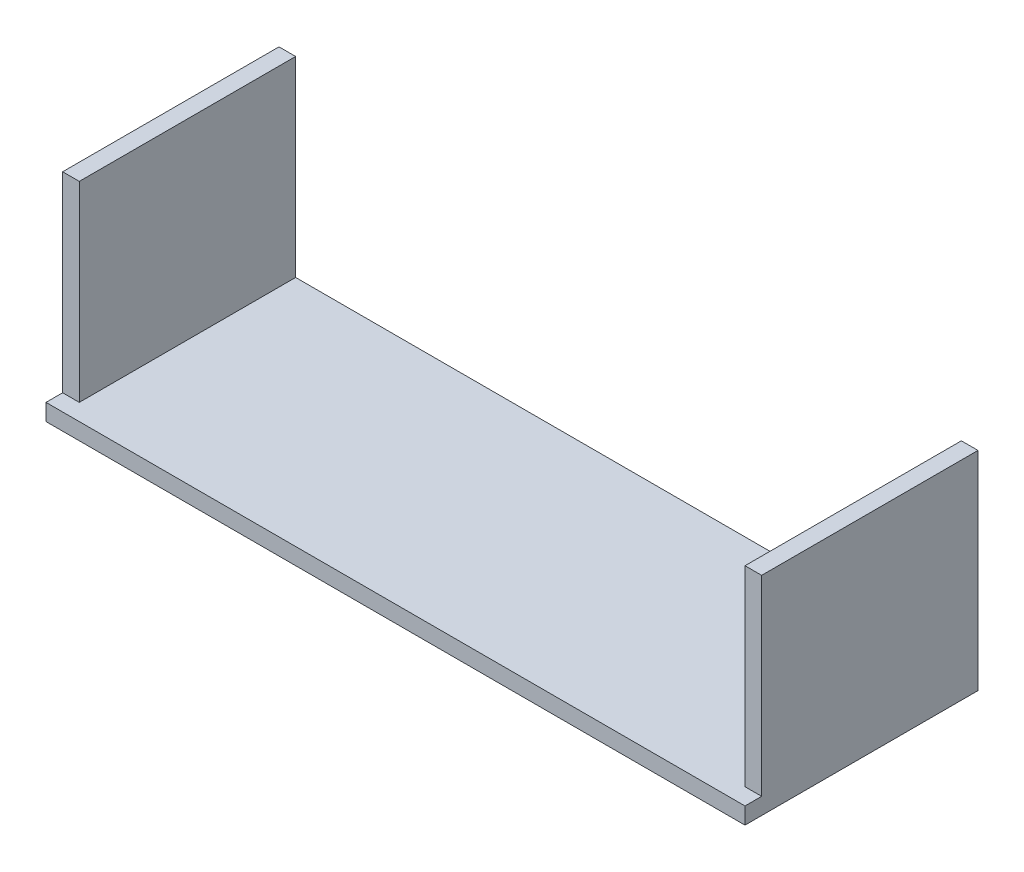
from build123d import *

# Parameters (mm, degrees)
SKETCH1_W          = 533.4
SKETCH1_H          = 177.8
EXTRUDE1_DEPTH     = 12.7
SKETCH2_W          = 12.7
SKETCH2_H          = 177.8
EXTRUDE2_DEPTH     = 146.05
SKETCH3_W          = 12.7
SKETCH3_H          = 146.05
EXTRUDE3_DEPTH     = 614.172
SKETCH4_W          = 73.66
SKETCH4_H          = 109.22
CUT_EXTRUDE1_DEPTH = 2.54
SKETCH5_W          = 1.738554187
SKETCH5_H          = 12.327929688
CUT_EXTRUDE2_DEPTH = 5.08


with BuildPart() as part:
    # Sketch1 → Extrude1 (new body)
    with BuildSketch(Plane(origin=(0, 0, 0), x_dir=(1, 0, 0), z_dir=(0, 1, 0))):
        with Locations((266.7, -88.9)):
            Rectangle(SKETCH1_W, SKETCH1_H)
    extrude(amount=EXTRUDE1_DEPTH)

    # Sketch2 → Extrude2 (add)
    with BuildSketch(Plane(origin=(0, 12.7, 0), x_dir=(1, 0, 0), z_dir=(0, 1, 0))):
        with Locations((6.35, -88.9)):
            Rectangle(SKETCH2_W, SKETCH2_H)
        with Locations((527.05, -88.9)):
            Rectangle(SKETCH2_W, SKETCH2_H)
    extrude(amount=EXTRUDE2_DEPTH)

    # Sketch3 → Extrude3 (cut)
    with BuildSketch(Plane.ZY):
        with Locations((171.45, 85.725)):
            Rectangle(SKETCH3_W, SKETCH3_H)
    extrude(amount=-EXTRUDE3_DEPTH, mode=Mode.SUBTRACT)

    # Sketch4 → Cut-Extrude1 (cut)
    with BuildSketch(Plane.XZ):
        with Locations((359.41, 85.09)):
            Rectangle(SKETCH4_W, SKETCH4_H)
    extrude(amount=-CUT_EXTRUDE1_DEPTH, mode=Mode.SUBTRACT)

    # Sketch5 → Cut-Extrude2 (cut)
    # profile 1 of 5: a face of its own
    with BuildSketch(Plane.XZ.offset(-2.54)):
        with BuildLine():
            Line((336.386352664, 108.191538564), (336.386352664, 120.519468252))
            Line((336.386352664, 120.519468252), (339.001592556, 120.519468252))
            Line((339.001592556, 120.519468252), (341.757596068, 111.868679451))
            add(Edge.make_bspline(
                [(341.757596068, 111.868679451), (341.787926004, 111.77068109), (341.846582334, 111.581157964), (341.933562713, 111.307469132), (342.012700275, 111.053136709), (342.083976112, 110.817351144), (342.15124004, 110.6012831), (342.209480003, 110.403159579), (342.265159303, 110.225182175), (342.29778986, 110.112071715), (342.313241937, 110.058508685)],
                knots=[0, 0, 0, 0, 1.300204174, 2.514519184, 3.639827924, 4.676153899, 5.636536826, 6.507959918, 7.293450077, 8, 8, 8, 8], degree=3))
            add(Edge.make_bspline(
                [(342.313241937, 110.058508685), (342.330451962, 110.116977416), (342.367075997, 110.241402613), (342.426449412, 110.437039906), (342.489624415, 110.653534585), (342.56522553, 110.88716546), (342.644030745, 111.141597465), (342.726747074, 111.416619304), (342.822158749, 111.709485212), (342.885564575, 111.912240781), (342.91827855, 112.016851683)],
                knots=[0, 0, 0, 0, 0.713638162, 1.518667645, 2.393860736, 3.354087503, 4.393659122, 5.512594909, 6.716633584, 8, 8, 8, 8], degree=3))
            Line((342.91827855, 112.016851683), (345.647117153, 120.519468252))
            Line((345.647117153, 120.519468252), (348.24013121, 120.519468252))
            Line((348.24013121, 120.519468252), (348.24013121, 108.191538564))
            Line((348.24013121, 108.191538564), (346.501577023, 108.191538564))
            Line((346.501577023, 108.191538564), (346.501577023, 118.622863685))
            Line((346.501577023, 118.622863685), (343.212153477, 108.191538564))
            Line((343.212153477, 108.191538564), (341.3945741, 108.191538564))
            Line((341.3945741, 108.191538564), (338.124906851, 118.622863685))
            Line((338.124906851, 118.622863685), (338.124906851, 108.191538564))
            Line((338.124906851, 108.191538564), (336.386352664, 108.191538564))
        make_face()
    # profile 2 of 5: a face of its own
    with BuildSketch(Plane.XZ.offset(-2.54)):
        with BuildLine():
            Line((350.452836538, 104.892236869), (350.294786158, 106.270238625))
            add(Edge.make_bspline(
                [(350.294786158, 106.270238625), (350.367736089, 106.249116813), (350.507580949, 106.208626345), (350.714754305, 106.171851362), (350.905470536, 106.14044253), (351.028946031, 106.138028524), (351.087507598, 106.136883617)],
                knots=[0, 0, 0, 0, 1.12915394, 2.164585651, 3.129505495, 4, 4, 4, 4], degree=3))
            add(Edge.make_bspline(
                [(351.087507598, 106.136883617), (351.160086866, 106.1384004), (351.299443818, 106.141312723), (351.496024524, 106.173484305), (351.671544013, 106.224588044), (351.823355908, 106.300765897), (351.960219021, 106.392508208), (352.076719207, 106.506836978), (352.189822074, 106.629233342), (352.248099349, 106.725117231), (352.277824527, 106.774024213)],
                knots=[0, 0, 0, 0, 1.222547858, 2.347372026, 3.34834, 4.291755468, 5.200225115, 6.113347104, 7.037685039, 8, 8, 8, 8], degree=3))
            add(Edge.make_bspline(
                [(352.277824527, 106.774024213), (352.289483805, 106.796180537), (352.316405222, 106.847339764), (352.357936264, 106.934995706), (352.402124663, 107.045043903), (352.450214904, 107.175907735), (352.509041193, 107.32605205), (352.565670741, 107.499625414), (352.634672445, 107.691725619), (352.677573149, 107.828345862), (352.700115388, 107.900133175)],
                knots=[0, 0, 0, 0, 0.499056455, 1.152327554, 1.932396574, 2.861927129, 3.931654914, 5.145911677, 6.500314985, 8, 8, 8, 8], degree=3))
            add(Edge.make_bspline(
                [(352.700115388, 107.900133175), (352.717363995, 107.952006248), (352.758185842, 108.07477295), (352.799648792, 108.19732471), (352.823592248, 108.268094218)],
                knots=[0, 0, 0, 0, 0.84506746, 2, 2, 2, 2], degree=3))
            Line((352.823592248, 108.268094218), (349.504534255, 117.200410259))
            Line((349.504534255, 117.200410259), (351.176410937, 117.200410259))
            Line((351.176410937, 117.200410259), (352.94459957, 112.253927254))
            add(Edge.make_bspline(
                [(352.94459957, 112.253927254), (353.0570561, 111.933246164), (353.285698891, 111.281248278), (353.467255306, 110.614593), (353.559514332, 110.275827959)],
                knots=[0, 0, 0, 0, 0.983687515, 2, 2, 2, 2], degree=3))
            add(Edge.make_bspline(
                [(353.559514332, 110.275827959), (353.601344152, 110.396888535), (353.689342716, 110.651567066), (353.830941091, 111.051051835), (353.983234968, 111.488736776), (354.091104291, 111.792188448), (354.147264185, 111.950174178)],
                knots=[0, 0, 0, 0, 0.866150559, 1.822145229, 2.866145716, 4, 4, 4, 4], degree=3))
            Line((354.147264185, 111.950174178), (355.98459986, 117.200410259))
            Line((355.98459986, 117.200410259), (357.649067931, 117.200410259))
            Line((357.649067931, 117.200410259), (354.421382814, 107.979158366))
            add(Edge.make_bspline(
                [(354.421382814, 107.979158366), (354.378346796, 107.867790215), (354.295799095, 107.654174153), (354.167519113, 107.350378032), (354.05264985, 107.0713086), (353.944836704, 106.818616208), (353.84022342, 106.595001499), (353.747102882, 106.396685834), (353.661327053, 106.225819995), (353.603482444, 106.122706994), (353.576801093, 106.075145187)],
                knots=[0, 0, 0, 0, 1.374607903, 2.636645431, 3.796610243, 4.849482013, 5.799414788, 6.638849055, 7.372156777, 8, 8, 8, 8], degree=3))
            add(Edge.make_bspline(
                [(353.576801093, 106.075145187), (353.510030241, 105.964076673), (353.381607947, 105.750455414), (353.157715973, 105.466925935), (352.919970239, 105.229122641), (352.664622245, 105.037010306), (352.387369537, 104.891712083), (352.087308307, 104.787019509), (351.761804332, 104.724583136), (351.536416459, 104.717870643), (351.42089512, 104.714430191)],
                knots=[0, 0, 0, 0, 1.154647028, 2.220765753, 3.212122198, 4.145795136, 5.058575804, 5.991786985, 6.970701249, 8, 8, 8, 8], degree=3))
            add(Edge.make_bspline(
                [(351.42089512, 104.714430191), (351.346720345, 104.717360803), (351.193641972, 104.723408861), (350.957087026, 104.756402486), (350.708347322, 104.814278136), (350.539806015, 104.865701667), (350.452836538, 104.892236869)],
                knots=[0, 0, 0, 0, 0.901275447, 1.860009393, 2.895737391, 4, 4, 4, 4], degree=3))
        make_face()
    # profile 3 of 5: a face of its own
    with BuildSketch(Plane.XZ.offset(-2.54)):
        with BuildLine():
            Line((359.145607472, 108.191538564), (359.145607472, 120.519468252))
            Line((359.145607472, 120.519468252), (364.494625041, 120.519468252))
            add(Edge.make_bspline(
                [(364.494625041, 120.519468252), (364.620578026, 120.518481358), (364.864345286, 120.516571341), (365.217858147, 120.503050587), (365.547826962, 120.473903389), (365.854858435, 120.442384756), (366.138898015, 120.394007865), (366.399652667, 120.338520664), (366.637524981, 120.272490055), (366.853578391, 120.194502816), (367.054028845, 120.106271938), (367.239831275, 119.99740928), (367.418709248, 119.878119019), (367.584023979, 119.737970764), (367.74013566, 119.584521398), (367.886899602, 119.415685867), (368.022143081, 119.229999025), (368.188949715, 118.964242645), (368.367899225, 118.610311111), (368.516992275, 118.157355437), (368.613124807, 117.683547269), (368.623411262, 117.359754274), (368.628630308, 117.195471185)],
                knots=[0, 0, 0, 0, 1.242255013, 2.404239178, 3.487702428, 4.508875116, 5.447164253, 6.327763259, 7.137389581, 7.87956647, 8.591787438, 9.293660819, 10.000726923, 10.709654955, 11.427269343, 12.158170644, 12.913245971, 13.690346794, 15.251572448, 16.809945773, 18.381459854, 20, 20, 20, 20], degree=3))
            add(Edge.make_bspline(
                [(368.628630308, 117.195471185), (368.626217947, 117.090016093), (368.621453367, 116.881735055), (368.584956207, 116.575506179), (368.518917543, 116.282916801), (368.434235973, 116.001404478), (368.318332738, 115.734957788), (368.18406387, 115.478134476), (368.017723833, 115.237990165), (367.831487767, 115.008130196), (367.617924941, 114.793477555), (367.375156647, 114.601776384), (367.105589393, 114.429340796), (366.807953624, 114.280928357), (366.485675427, 114.145272342), (366.134711096, 114.036035583), (365.756477095, 113.946835392), (365.494267703, 113.903641218), (365.35896306, 113.881352266)],
                knots=[0, 0, 0, 0, 0.982609109, 1.940720374, 2.867584677, 3.775009516, 4.675469332, 5.571146231, 6.471115823, 7.392408543, 8.32534739, 9.286126426, 10.269214477, 11.301811357, 12.381622301, 13.524260118, 14.722474812, 16, 16, 16, 16], degree=3))
            add(Edge.make_bspline(
                [(365.35896306, 113.881352266), (365.458214142, 113.831212809), (365.64669552, 113.735996174), (365.907650323, 113.586697318), (366.128852676, 113.434150677), (366.257006409, 113.325044836), (366.317143492, 113.273846116)],
                knots=[0, 0, 0, 0, 1.172304973, 2.226249348, 3.167654437, 4, 4, 4, 4], degree=3))
            add(Edge.make_bspline(
                [(366.317143492, 113.273846116), (366.433602351, 113.159682401), (366.672817122, 112.925182019), (367.002465466, 112.525759176), (367.322070857, 112.08114026), (367.51625523, 111.759812663), (367.616120058, 111.594560822)],
                knots=[0, 0, 0, 0, 0.918110279, 1.885863737, 2.912745394, 4, 4, 4, 4], degree=3))
            Line((367.616120058, 111.594560822), (369.638671022, 108.191538564))
            Line((369.638671022, 108.191538564), (367.645754504, 108.191538564))
            Line((367.645754504, 108.191538564), (366.109702368, 110.79443077))
            add(Edge.make_bspline(
                [(366.109702368, 110.79443077), (366.054473648, 110.885756372), (365.947449459, 111.062730392), (365.792856851, 111.32119243), (365.641283882, 111.559147917), (365.500702546, 111.783397751), (365.365407817, 111.989870787), (365.236706957, 112.179284272), (365.118141874, 112.354123063), (364.971283689, 112.557680916), (364.800365153, 112.78291957), (364.600914949, 113.01487285), (364.41097922, 113.19980611), (364.177069864, 113.381152844), (363.88733774, 113.550772231), (363.641059965, 113.62870768), (363.521627385, 113.66650253)],
                knots=[0, 0, 0, 0, 1.130940588, 2.191577161, 3.191089816, 4.120344442, 4.99615009, 5.80661983, 6.546979556, 7.234477901, 8.466216387, 9.541989141, 10.473533583, 11.269175393, 12.675684693, 14, 14, 14, 14], degree=3))
            add(Edge.make_bspline(
                [(363.521627385, 113.66650253), (363.471517901, 113.675538973), (363.357116447, 113.696169443), (363.162863064, 113.709643236), (362.927501259, 113.723943865), (362.756930547, 113.723527193), (362.664697978, 113.723301886)],
                knots=[0, 0, 0, 0, 0.709978628, 1.620902492, 2.713552433, 4, 4, 4, 4], degree=3))
            Line((362.664697978, 113.723301886), (360.884161659, 113.723301886))
            Line((360.884161659, 113.723301886), (360.884161659, 108.191538564))
            Line((360.884161659, 108.191538564), (359.145607472, 108.191538564))
        make_face()
        with BuildLine():
            Line((360.884161659, 115.145755311), (364.185932891, 115.145755311))
            add(Edge.make_bspline(
                [(364.185932891, 115.145755311), (364.351496207, 115.148345706), (364.661001298, 115.153188207), (365.093795205, 115.194538073), (365.462631909, 115.260244766), (365.774802788, 115.356085673), (366.037075601, 115.489144678), (366.26517925, 115.65130194), (366.454736253, 115.854420792), (366.612428099, 116.083597171), (366.735005205, 116.335794337), (366.823426484, 116.600690483), (366.881299748, 116.87605933), (366.887124753, 117.063471555), (366.890076122, 117.158428127)],
                knots=[0, 0, 0, 0, 1.546323217, 2.890706218, 4.056530419, 5.041445823, 5.928701482, 6.793137403, 7.641659452, 8.509781392, 9.383301667, 10.251423607, 11.114044887, 12, 12, 12, 12], degree=3))
            add(Edge.make_bspline(
                [(366.890076122, 117.158428127), (366.887781556, 117.227626591), (366.883287176, 117.363166055), (366.859726149, 117.562100357), (366.813917919, 117.751133925), (366.753428264, 117.931266014), (366.67260181, 118.101177283), (366.57658328, 118.262184357), (366.462003531, 118.41339487), (366.330759022, 118.555269433), (366.180066474, 118.68436142), (366.007940158, 118.795739806), (365.815737623, 118.890387406), (365.603235466, 118.965506068), (365.371103106, 119.02558877), (365.118019066, 119.065559854), (364.845140752, 119.094482797), (364.656051906, 119.096155048), (364.558833008, 119.097014826)],
                knots=[0, 0, 0, 0, 0.965208469, 1.890559848, 2.786986821, 3.67262109, 4.535197034, 5.405224191, 6.282113641, 7.175449223, 8.095446547, 9.040936516, 10.026471658, 11.075712529, 12.17809725, 13.364958037, 14.645208957, 16, 16, 16, 16], degree=3))
            Line((364.558833008, 119.097014826), (360.884161659, 119.097014826))
            Line((360.884161659, 119.097014826), (360.884161659, 115.145755311))
        make_face(mode=Mode.SUBTRACT)
    # profile 4 of 5: a face of its own
    with BuildSketch(Plane.XZ.offset(-2.54)):
        with Locations((372.500864633, 114.355503408)):
            Rectangle(SKETCH5_W, SKETCH5_H)
    # profile 5 of 5: a face of its own
    with BuildSketch(Plane.XZ.offset(-2.54)):
        with BuildLine():
            add(Edge.make_bspline(
                [(375.582847055, 114.192513953), (375.587131769, 114.439678318), (375.595480317, 114.921265548), (375.673485299, 115.622518608), (375.800145368, 116.282306009), (375.981217144, 116.900576349), (376.21072614, 117.47829846), (376.489738168, 118.016780507), (376.826645724, 118.50992726), (377.207774024, 118.962433156), (377.633476829, 119.362481535), (378.086729321, 119.717781811), (378.5731912, 120.014144246), (379.088367933, 120.258841915), (379.634448284, 120.4467137), (380.209899024, 120.578241044), (380.814104713, 120.663088962), (381.227093443, 120.672638878), (381.438119749, 120.677518633)],
                knots=[0, 0, 0, 0, 1.203621547, 2.345195544, 3.432004029, 4.472479546, 5.478447225, 6.455936844, 7.420185704, 8.381829745, 9.332027588, 10.260832629, 11.182364398, 12.100723901, 13.034044877, 13.989196293, 14.972532542, 16, 16, 16, 16], degree=3))
            add(Edge.make_bspline(
                [(381.438119749, 120.677518633), (381.577306099, 120.675088177), (381.853705016, 120.670261731), (382.262336146, 120.633538927), (382.660466893, 120.567995084), (383.047705199, 120.480158984), (383.425105127, 120.36492184), (383.792892054, 120.228887898), (384.147846418, 120.06032269), (384.492329633, 119.871597165), (384.822275332, 119.660499505), (385.132357474, 119.427300348), (385.421833314, 119.17376337), (385.694591298, 118.904056027), (385.941529875, 118.609076072), (386.172850706, 118.297809101), (386.381906652, 117.964735846), (386.569439489, 117.612585278), (386.737112902, 117.246796298), (386.880422213, 116.865852861), (387.003479302, 116.474324648), (387.106488468, 116.069894231), (387.180400324, 115.652699873), (387.239257134, 115.224539223), (387.270235099, 114.784012907), (387.275771728, 114.48642953), (387.27857522, 114.335747111)],
                knots=[0, 0, 0, 0, 1.034375294, 2.054082248, 3.045783978, 4.031219655, 5.002789406, 5.976610191, 6.94273282, 7.920236376, 8.894345378, 9.851183672, 10.800797181, 11.752517031, 12.698794154, 13.65688337, 14.632873302, 15.61821402, 16.620222298, 17.621258913, 18.640965868, 19.669244166, 20.720417492, 21.788124603, 22.880008887, 24, 24, 24, 24], degree=3))
            add(Edge.make_bspline(
                [(387.27857522, 114.335747111), (387.276006611, 114.182579934), (387.27093188, 113.879971767), (387.236594177, 113.432926919), (387.176216558, 112.9987158), (387.096135928, 112.576043674), (386.988830327, 112.165790454), (386.861314111, 111.76677992), (386.707076043, 111.381388658), (386.532881269, 111.008687795), (386.335779957, 110.653803262), (386.118363835, 110.319216579), (385.880478879, 110.00805754), (385.625738532, 109.716509017), (385.348193934, 109.449784444), (385.051262667, 109.20538975), (384.73608643, 108.981020016), (384.40160639, 108.782751874), (384.053825249, 108.608962767), (383.699625046, 108.454780518), (383.338742675, 108.32328776), (382.969944749, 108.21672595), (382.594237314, 108.136200176), (382.212677654, 108.075901627), (381.824014964, 108.041181516), (381.562486096, 108.036065806), (381.430711138, 108.033488184)],
                knots=[0, 0, 0, 0, 1.141429366, 2.255090526, 3.338676798, 4.407031443, 5.458968682, 6.496860253, 7.526652771, 8.550250826, 9.560787671, 10.54935636, 11.521089193, 12.477323897, 13.431786008, 14.386110112, 15.340986122, 16.312041, 17.28047646, 18.236612773, 19.189437236, 20.140779471, 21.09494583, 22.051062463, 23.018000708, 24, 24, 24, 24], degree=3))
            add(Edge.make_bspline(
                [(381.430711138, 108.033488184), (381.28902379, 108.035584466), (381.008376637, 108.039736675), (380.593572588, 108.081182803), (380.189088211, 108.144410314), (379.796099415, 108.235691739), (379.415143204, 108.354774806), (379.045768818, 108.498909184), (378.68667713, 108.666168559), (378.342323873, 108.861342117), (378.013881085, 109.078354133), (377.704532152, 109.316125851), (377.414448132, 109.572465993), (377.148283687, 109.851611556), (376.897418588, 110.143443405), (376.671883549, 110.45880875), (376.464312948, 110.790555433), (376.280849138, 111.141881349), (376.115117042, 111.502346425), (375.975484171, 111.872065963), (375.852773939, 112.24559128), (375.75504766, 112.62522463), (375.677171709, 113.010090286), (375.624805775, 113.399547843), (375.586986699, 113.794177334), (375.58423388, 114.059066892), (375.582847055, 114.192513953)],
                knots=[0, 0, 0, 0, 1.072727997, 2.12480551, 3.153819198, 4.171534612, 5.177148798, 6.173931848, 7.17235114, 8.174500385, 9.168706755, 10.151274001, 11.127173509, 12.097141049, 13.070188938, 14.039134204, 15.03036519, 16.031505612, 17.038625933, 18.033164522, 19.022845559, 20.014762458, 21.000193215, 21.994692725, 22.989758729, 24, 24, 24, 24], degree=3))
        make_face()
        with BuildLine():
            add(Edge.make_bspline(
                [(377.321401242, 114.172757656), (377.324065494, 113.994777012), (377.329260597, 113.647727319), (377.388695389, 113.141747321), (377.478878194, 112.664329425), (377.603185671, 112.214133406), (377.770285361, 111.795611634), (377.970074676, 111.404742523), (378.20928057, 111.044124346), (378.482625447, 110.714765897), (378.783273475, 110.418894945), (379.104546405, 110.160467408), (379.446516456, 109.944052625), (379.805392283, 109.765356023), (380.183751523, 109.62586703), (380.580460985, 109.527921374), (380.995812151, 109.466664317), (381.279030424, 109.459560375), (381.423302526, 109.455941609)],
                knots=[0, 0, 0, 0, 1.215430442, 2.370003584, 3.475209778, 4.53279855, 5.55522989, 6.548792651, 7.526809858, 8.505409025, 9.467826767, 10.404123909, 11.316848639, 12.227335424, 13.138360512, 14.065900994, 15.014765094, 16, 16, 16, 16], degree=3))
            add(Edge.make_bspline(
                [(381.423302526, 109.455941609), (381.570020047, 109.459613899), (381.857292539, 109.466804232), (382.278905687, 109.526991935), (382.679485374, 109.629458934), (383.063002061, 109.765865721), (383.422522137, 109.950264443), (383.766453749, 110.166194338), (384.085421278, 110.430054484), (384.387254474, 110.726448715), (384.657978518, 111.063355194), (384.898189114, 111.432474842), (385.093319295, 111.839343516), (385.26178787, 112.274998455), (385.38515027, 112.747673705), (385.476322643, 113.251995896), (385.531265045, 113.789587275), (385.537050763, 114.158633782), (385.540021034, 114.348094797)],
                knots=[0, 0, 0, 0, 0.976878588, 1.912725521, 2.8289017, 3.727303729, 4.617335839, 5.514666588, 6.426584173, 7.368641557, 8.327632997, 9.299405846, 10.294892156, 11.327373912, 12.405931897, 13.542618837, 14.738430195, 16, 16, 16, 16], degree=3))
            add(Edge.make_bspline(
                [(385.540021034, 114.348094797), (385.538971341, 114.469981682), (385.536912224, 114.709079642), (385.509642615, 115.06151277), (385.474468319, 115.402983211), (385.420914906, 115.733050344), (385.347111508, 116.050347287), (385.265349876, 116.357289627), (385.163109815, 116.651232305), (385.047104217, 116.933328052), (384.917295917, 117.20212864), (384.770889419, 117.455367975), (384.609586266, 117.692061518), (384.437738607, 117.916696738), (384.245830488, 118.120579333), (384.0431024, 118.312321398), (383.824949382, 118.4879615), (383.59354852, 118.647545518), (383.352182536, 118.791196286), (383.101349004, 118.914142704), (382.845044059, 119.022135686), (382.57897752, 119.104916838), (382.306823251, 119.171681053), (382.027481061, 119.222394693), (381.739914106, 119.248656575), (381.546002064, 119.252913656), (381.447997898, 119.255065207)],
                knots=[0, 0, 0, 0, 1.220438779, 2.394059227, 3.538503547, 4.658058814, 5.74010225, 6.800155734, 7.837851593, 8.854470756, 9.853724944, 10.825214244, 11.781044712, 12.72106398, 13.654479919, 14.581868691, 15.514082315, 16.456304431, 17.39516604, 18.324312202, 19.252140633, 20.177768678, 21.111585046, 22.057694709, 23.018348693, 24, 24, 24, 24], degree=3))
            add(Edge.make_bspline(
                [(381.447997898, 119.255065207), (381.309482379, 119.252314344), (381.036175826, 119.246886583), (380.633836044, 119.1865486), (380.245936871, 119.096395409), (379.871876328, 118.970356444), (379.514853698, 118.803461046), (379.173019277, 118.598786682), (378.843338785, 118.36190631), (378.531010811, 118.087048394), (378.239852824, 117.771303744), (377.993707955, 117.399050477), (377.786250335, 116.979175061), (377.613027044, 116.512741781), (377.480949386, 115.996138421), (377.389667204, 115.431588168), (377.332033497, 114.818496123), (377.325035931, 114.393506585), (377.321401242, 114.172757656)],
                knots=[0, 0, 0, 0, 0.895090134, 1.766112571, 2.624765742, 3.468151641, 4.313618154, 5.168136083, 6.041303099, 6.935189387, 7.854749729, 8.809996334, 9.809869957, 10.877771942, 12.021723904, 13.25217762, 14.572720513, 16, 16, 16, 16], degree=3))
        make_face(mode=Mode.SUBTRACT)
    extrude(amount=-CUT_EXTRUDE2_DEPTH, mode=Mode.SUBTRACT)


solid = part.part
